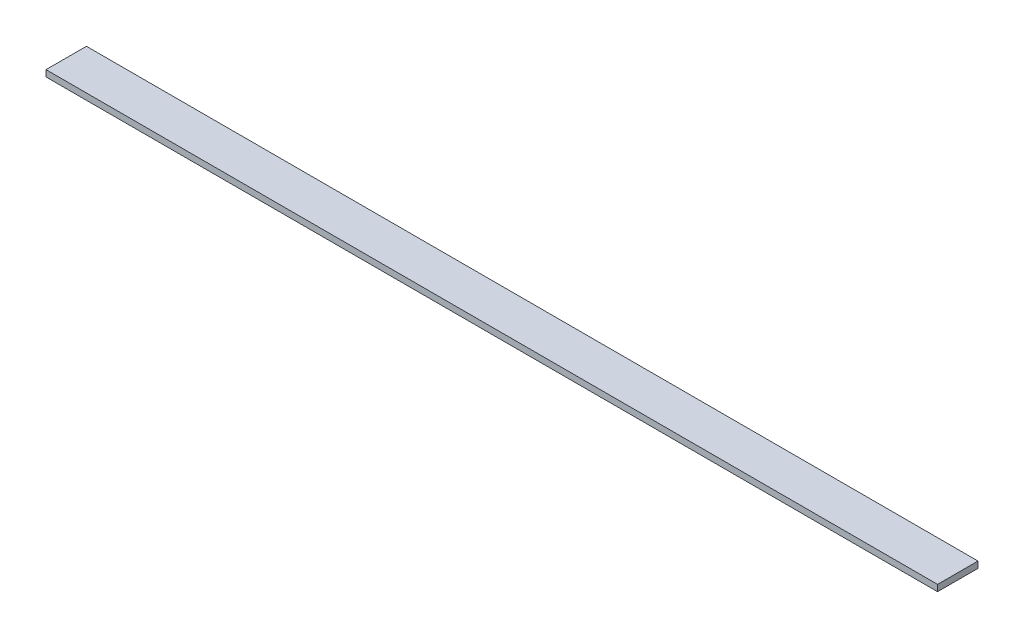
from build123d import *

# Parameters (mm, degrees)
CROQUIS1_W              = 280
CROQUIS1_H              = 12.7
SALIENTE_EXTRUIR1_DEPTH = 2


with BuildPart() as part:
    # Croquis1 → Saliente-Extruir1 (new body)
    with BuildSketch(Plane(origin=(0, 0, 0), x_dir=(1, 0, 0), z_dir=(0, 1, 0))):
        with Locations((-140, -6.35)):
            Rectangle(CROQUIS1_W, CROQUIS1_H)
    extrude(amount=SALIENTE_EXTRUIR1_DEPTH)


solid = part.part
